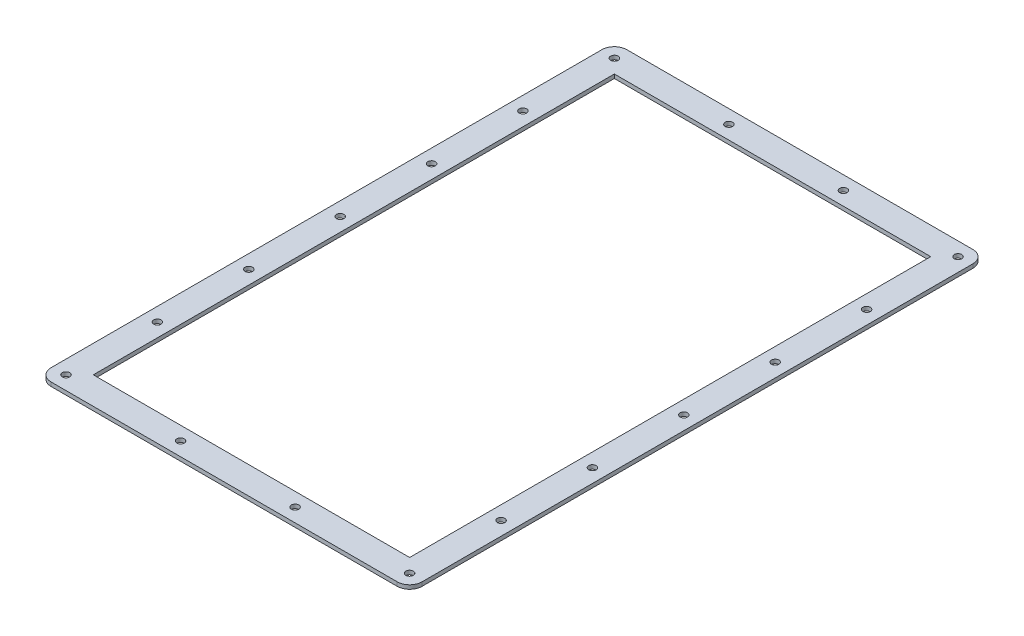
from build123d import *

# Parameters (mm, degrees)
SKETCH1_W           = 299
SKETCH1_H           = 464
SKETCH1_R           = 3
SKETCH1_W_2         = 255
SKETCH1_H_2         = 420
BOSS_EXTRUDE1_DEPTH = 3.175
FILLET1_R           = 10


with BuildPart() as part:
    # Sketch1 → Boss-Extrude1 (new body)
    with BuildSketch(Plane(origin=(0, 0, 0), x_dir=(1, 0, 0), z_dir=(0, 1, 0))):
        with Locations((2.5, -40)):
            Rectangle(SKETCH1_W, SKETCH1_H)
        with Locations(Location((141, 181, 0), (0, 0, 270))):
            Circle(SKETCH1_R, mode=Mode.SUBTRACT)
        with Locations(Location((48.666666667, 181, 0), (0, 0, 270))):
            Circle(SKETCH1_R, mode=Mode.SUBTRACT)
        with Locations(Location((-43.666666667, 181, 0), (0, 0, 270))):
            Circle(SKETCH1_R, mode=Mode.SUBTRACT)
        with Locations(Location((-136, 181, 0), (0, 0, 270))):
            Circle(SKETCH1_R, mode=Mode.SUBTRACT)
        with Locations(Location((141, 107.333333333, 0), (0, 0, 270))):
            Circle(SKETCH1_R, mode=Mode.SUBTRACT)
        with Locations(Location((141, 33.666666667, 0), (0, 0, 270))):
            Circle(SKETCH1_R, mode=Mode.SUBTRACT)
        with Locations(Location((141, -40, 0), (0, 0, 270))):
            Circle(SKETCH1_R, mode=Mode.SUBTRACT)
        with Locations(Location((141, -113.666666667, 0), (0, 0, 270))):
            Circle(SKETCH1_R, mode=Mode.SUBTRACT)
        with Locations(Location((141, -187.333333333, 0), (0, 0, 270))):
            Circle(SKETCH1_R, mode=Mode.SUBTRACT)
        with Locations(Location((-136, 107.333333333, 0), (0, 0, 270))):
            Circle(SKETCH1_R, mode=Mode.SUBTRACT)
        with Locations(Location((141, -261, 0), (0, 0, 270))):
            Circle(SKETCH1_R, mode=Mode.SUBTRACT)
        with Locations(Location((-136, 33.666666667, 0), (0, 0, 270))):
            Circle(SKETCH1_R, mode=Mode.SUBTRACT)
        with Locations(Location((48.666666667, -261, 0), (0, 0, 270))):
            Circle(SKETCH1_R, mode=Mode.SUBTRACT)
        with Locations(Location((-136, -40, 0), (0, 0, 270))):
            Circle(SKETCH1_R, mode=Mode.SUBTRACT)
        with Locations(Location((-43.666666667, -261, 0), (0, 0, 270))):
            Circle(SKETCH1_R, mode=Mode.SUBTRACT)
        with Locations(Location((-136, -113.666666667, 0), (0, 0, 270))):
            Circle(SKETCH1_R, mode=Mode.SUBTRACT)
        with Locations(Location((-136, -261, 0), (0, 0, 270))):
            Circle(SKETCH1_R, mode=Mode.SUBTRACT)
        with Locations(Location((-136, -187.333333333, 0), (0, 0, 270))):
            Circle(SKETCH1_R, mode=Mode.SUBTRACT)
        with Locations((2.5, -40)):
            Rectangle(SKETCH1_W_2, SKETCH1_H_2, mode=Mode.SUBTRACT)
    extrude(amount=BOSS_EXTRUDE1_DEPTH)

    # Fillet1
    fillet1_edges = [part.edges().sort_by_distance(p)[0] for p in [
        (-147, 1.5875, -192),
        (152, 1.5875, -192),
        (152, 1.5875, 272),
        (-147, 1.5875, 272),
    ]]
    fillet(fillet1_edges, radius=FILLET1_R)


solid = part.part
